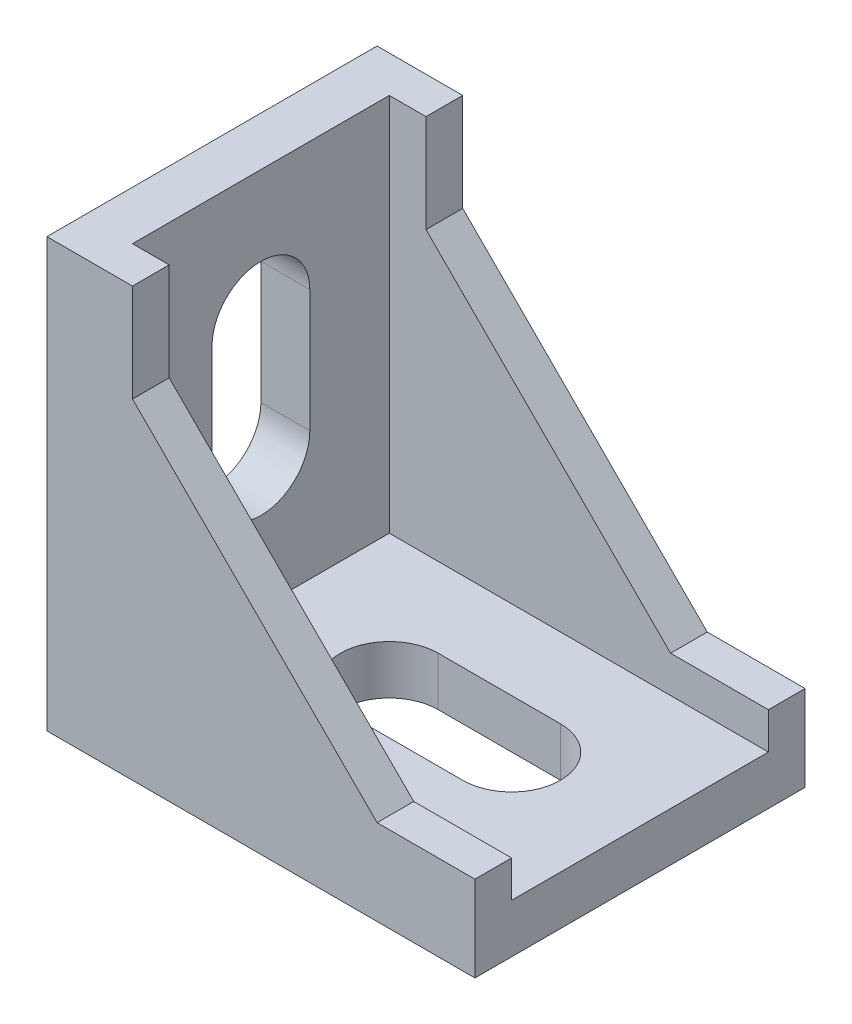
from build123d import *

# Parameters (mm, degrees)
SKETCH1_W           = 35
SKETCH1_H           = 35
BOSS_EXTRUDE1_DEPTH = 27
SKETCH2_W           = 31
SKETCH2_H           = 21
CUT_EXTRUDE1_DEPTH  = 31
CUT_EXTRUDE2_DEPTH  = 37.626493144
CUT_EXTRUDE3_DEPTH  = 45.679413604
CUT_EXTRUDE4_DEPTH  = 45.679413604
SKETCH7_W           = 31
SKETCH7_H           = 3.5
CUT_EXTRUDE5_DEPTH  = 1
SKETCH8_W           = 31
SKETCH8_H           = 3.5
CUT_EXTRUDE6_DEPTH  = 1
SKETCH9_W           = 3.5
SKETCH9_H           = 31
CUT_EXTRUDE13_DEPTH = 1
SKETCH10_W          = 3.5
SKETCH10_H          = 31
CUT_EXTRUDE14_DEPTH = 1


with BuildPart() as part:
    # Sketch1 → Boss-Extrude1 (new body)
    with BuildSketch(Plane.XY):
        Rectangle(SKETCH1_W, SKETCH1_H)
    extrude(amount=BOSS_EXTRUDE1_DEPTH)

    # Sketch2 → Cut-Extrude1 (cut)
    with BuildSketch(Plane(origin=(0, 17.5, 0), x_dir=(1, 0, 0), z_dir=(0, 1, 0))):
        with Locations((2, -13.5)):
            Rectangle(SKETCH2_W, SKETCH2_H)
    extrude(amount=-CUT_EXTRUDE1_DEPTH, mode=Mode.SUBTRACT)

    # Sketch3 → Cut-Extrude2 (cut, through all)
    with BuildSketch(Plane.XY.offset(27)):
        Polygon((17.5, 17.5), (-10.5, 17.5), (-10.5, 9.5), (9.5, -10.5), (17.5, -10.5), align=None)
    extrude(amount=-CUT_EXTRUDE2_DEPTH, mode=Mode.SUBTRACT)

    # Sketch4 → Cut-Extrude3 (cut, through all)
    with BuildSketch(Plane(origin=(-13.5, 0, 0), x_dir=(0, 0, -1), z_dir=(1, 0, 0))):
        with BuildLine():
            Line((-9.5, 7), (-9.5, -3))
            ThreePointArc((-9.5, -3), (-13.5, -7), (-17.5, -3))
            Line((-17.5, -3), (-17.5, 7))
            ThreePointArc((-17.5, 7), (-13.5, 11), (-9.5, 7))
        make_face()
    extrude(amount=-CUT_EXTRUDE3_DEPTH, mode=Mode.SUBTRACT)

    # Sketch5 → Cut-Extrude4 (cut, through all)
    with BuildSketch(Plane(origin=(0, -13.5, 0), x_dir=(1, 0, 0), z_dir=(0, 1, 0))):
        with BuildLine():
            Line((-3, -9.5), (7, -9.5))
            ThreePointArc((7, -9.5), (11, -13.5), (7, -17.5))
            Line((7, -17.5), (-3, -17.5))
            ThreePointArc((-3, -17.5), (-7, -13.5), (-3, -9.5))
        make_face()
    extrude(amount=-CUT_EXTRUDE4_DEPTH, mode=Mode.SUBTRACT)

    # Sketch7 → Cut-Extrude5 (cut)
    with BuildSketch(Plane.XZ.offset(17.5)):
        with Locations((0, 22.25)):
            Rectangle(SKETCH7_W, SKETCH7_H)
    extrude(amount=-CUT_EXTRUDE5_DEPTH, mode=Mode.SUBTRACT)

    # Sketch8 → Cut-Extrude6 (cut)
    with BuildSketch(Plane.XZ.offset(17.5)):
        with Locations((0, 4.75)):
            Rectangle(SKETCH8_W, SKETCH8_H)
    extrude(amount=-CUT_EXTRUDE6_DEPTH, mode=Mode.SUBTRACT)

    # Sketch9 → Cut-Extrude13 (cut)
    with BuildSketch(Plane.ZY.offset(17.5)):
        with Locations((22.25, 0)):
            Rectangle(SKETCH9_W, SKETCH9_H)
    extrude(amount=-CUT_EXTRUDE13_DEPTH, mode=Mode.SUBTRACT)

    # Sketch10 → Cut-Extrude14 (cut)
    with BuildSketch(Plane.ZY.offset(17.5)):
        with Locations((4.75, 0)):
            Rectangle(SKETCH10_W, SKETCH10_H)
    extrude(amount=-CUT_EXTRUDE14_DEPTH, mode=Mode.SUBTRACT)


solid = part.part
